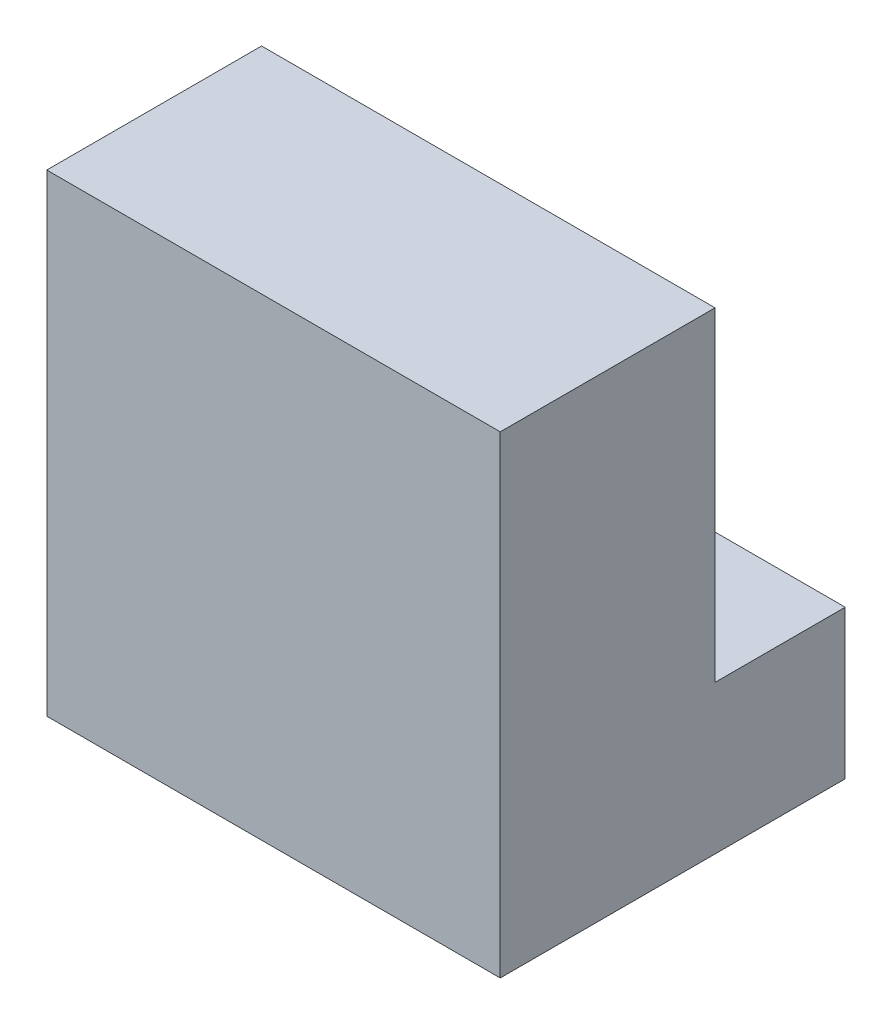
from build123d import *

# Parameters (mm, degrees)
SKETCH1_W           = 41.8
SKETCH1_H           = 43.6
BOSS_EXTRUDE1_DEPTH = 19.8
SKETCH2_W           = 41.8
SKETCH2_H           = 13.7
BOSS_EXTRUDE2_DEPTH = 12


with BuildPart() as part:
    # Sketch1 → Boss-Extrude1 (new body)
    with BuildSketch(Plane.XY):
        Rectangle(SKETCH1_W, SKETCH1_H)
    extrude(amount=BOSS_EXTRUDE1_DEPTH)

    # Sketch2 → Boss-Extrude2 (add)
    with BuildSketch(Plane(origin=(0, 0, 0), x_dir=(-1, 0, 0), z_dir=(0, 0, -1))):
        with Locations((0, -14.95)):
            Rectangle(SKETCH2_W, SKETCH2_H)
    extrude(amount=BOSS_EXTRUDE2_DEPTH)


solid = part.part
